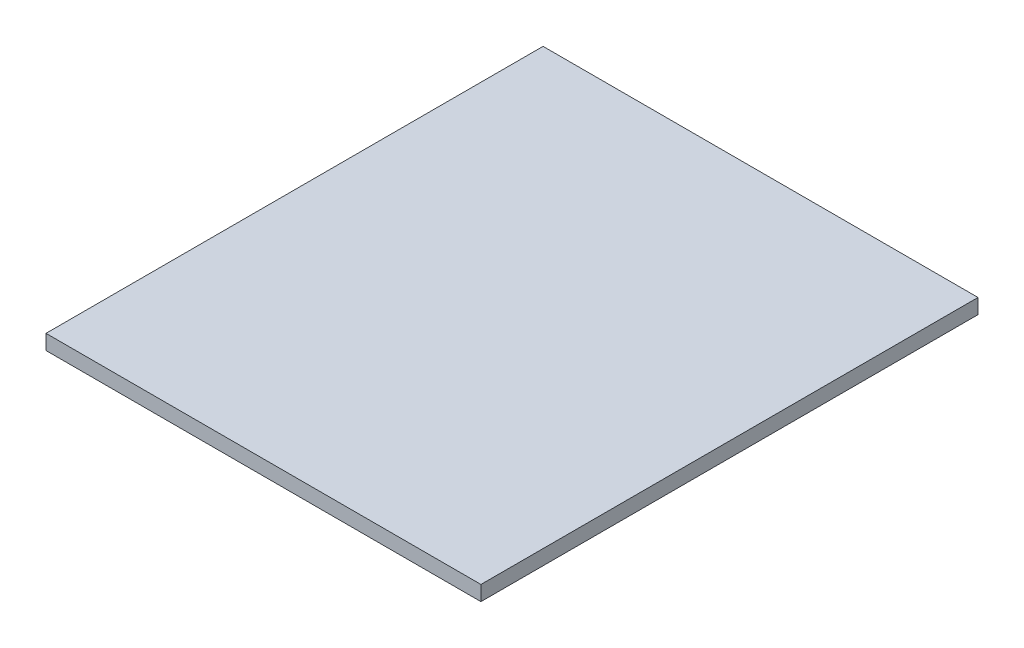
from build123d import *

# Parameters (mm, degrees)
SKETCH1_W           = 175
SKETCH1_H           = 200
BOSS_EXTRUDE1_DEPTH = 6


with BuildPart() as part:
    # Sketch1 → Boss-Extrude1 (new body)
    with BuildSketch(Plane(origin=(0, 0, 0), x_dir=(1, 0, 0), z_dir=(0, 1, 0))):
        with Locations((87.5, -100)):
            Rectangle(SKETCH1_W, SKETCH1_H)
    extrude(amount=BOSS_EXTRUDE1_DEPTH)


solid = part.part
